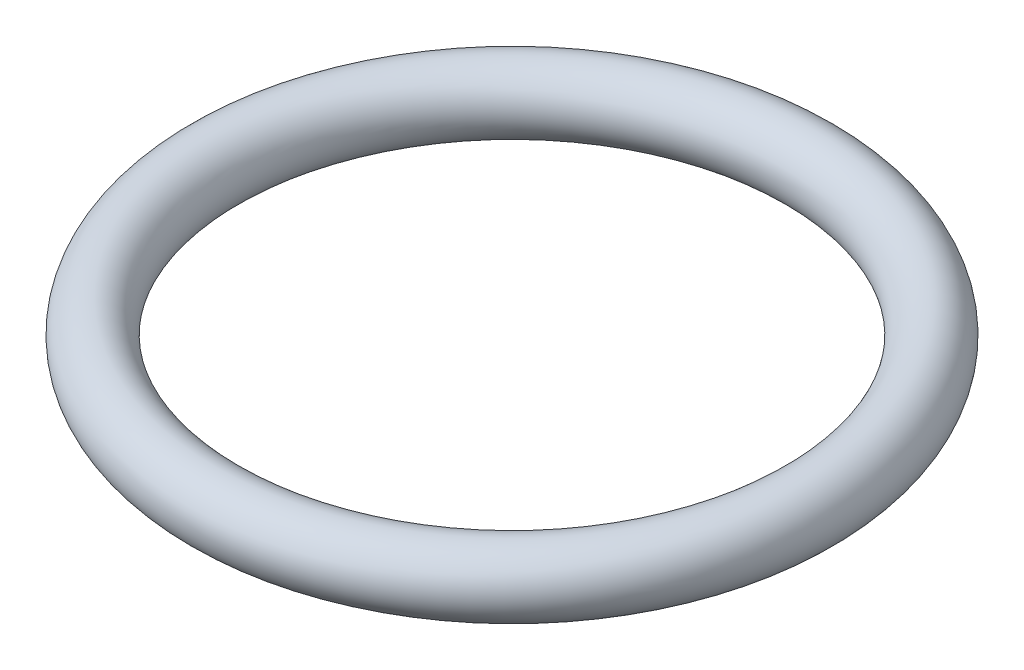
from build123d import *

# Parameters (mm, degrees)
IZIM3_R = 2.5


with BuildPart() as part:
    # Süpür1: sweep along a path in Çizim2
    with BuildLine(Plane(origin=(0, 0, 0), x_dir=(1, 0, 0), z_dir=(0, 1, 0))) as s_p_r1_path:
        CenterArc((0, 0), 20, 0, 360)
    # Çizim3 → Süpür1 (sweep)
    with BuildSketch(Plane.XY):
        with Locations((22.5, 0)):
            Circle(IZIM3_R)
    sweep(path=s_p_r1_path.line)


solid = part.part
